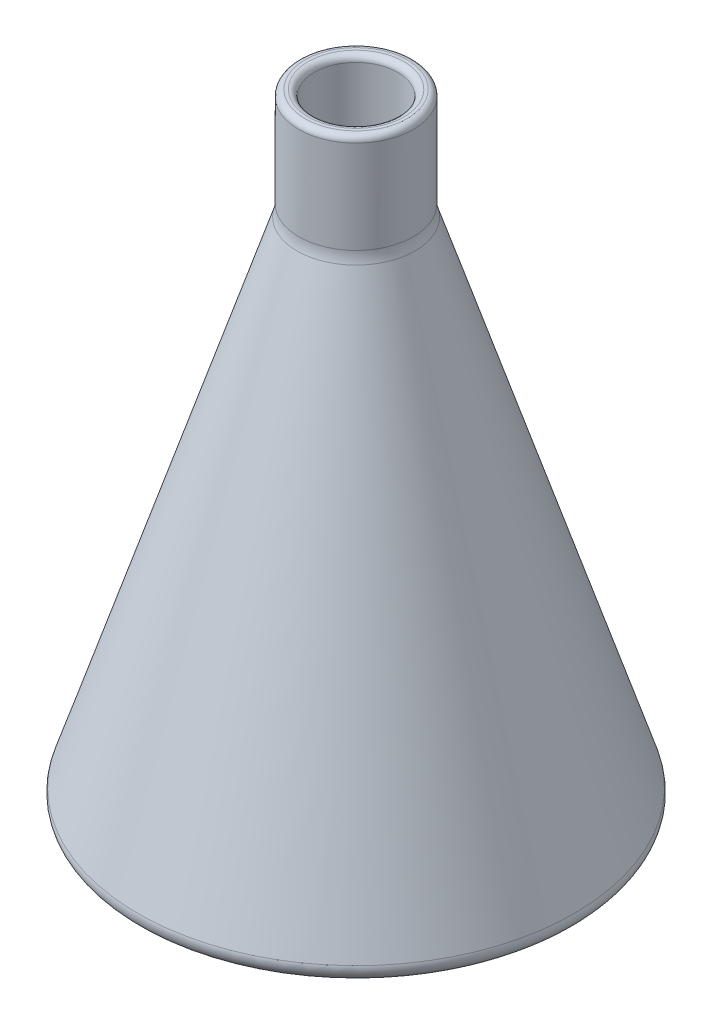
from build123d import *

# Parameters (mm, degrees)
FILLET1_R      = 7.62
FILLET2_R      = 1.27
FILLET3_R      = 2.54
FILLET4_R      = 2.54
REVOLVE2_ANGLE = 20


with BuildPart() as part:
    # Sketch2 → Revolve1 (revolve)
    with BuildSketch(Plane.XY, mode=Mode.PRIVATE) as revolve1_sk:
        Polygon((-11.704475972, 127), (-8.529475972, 127), (-8.529475972, 105.527709861), (-41.475985329, 3.175), (0, 3.175), (0, 0), (-45.672992146, 0), (-11.704475972, 105.527709861), align=None)
    revolve(revolve1_sk.sketch.rotate(Axis((0, 0, 0), (0, 1, 0)), 270), axis=Axis((0, 0, 0), (0, 1, 0)))

    # Fillet1
    fillet1_edges = [part.edges().sort_by_distance(p)[0] for p in [
        (0, 105.527709861, 11.704475972),
    ]]
    fillet(fillet1_edges, radius=FILLET1_R)

    # Fillet2
    fillet2_edges = [part.edges().sort_by_distance(p)[0] for p in [
        (0, 127, 11.704475972),
        (0, 127, 8.529475972),
    ]]
    fillet(fillet2_edges, radius=FILLET2_R)

    # Fillet3
    fillet3_edges = [part.edges().sort_by_distance(p)[0] for p in [
        (0, 0, 45.672992146),
    ]]
    fillet(fillet3_edges, radius=FILLET3_R)

    # Fillet4
    fillet4_edges = [part.edges().sort_by_distance(p)[0] for p in [
        (0, 3.175, 41.475985329),
    ]]
    fillet(fillet4_edges, radius=FILLET4_R)

    # Sketch3 → Revolve2 (revolve)
    with BuildSketch(Plane.XY):
        Polygon((-42.578605395, 9.61312368), (-42.691844754, 9.649574513), (-41.913566134, 12.067400477), (-41.800326776, 12.030949643), align=None)
        Polygon((-38.687212298, 21.702253498), (-38.800451656, 21.738704331), (-38.022173037, 24.156530295), (-37.908933678, 24.120079461), align=None)
        Polygon((-34.7958192, 33.791383316), (-34.909058559, 33.82783415), (-34.130779939, 36.245660113), (-34.017540581, 36.20920928), align=None)
        Polygon((-30.904426103, 45.880513134), (-31.017665461, 45.916963968), (-30.239386842, 48.334789931), (-30.126147483, 48.298339098), align=None)
        Polygon((-27.013033005, 57.969642952), (-27.126272364, 58.006093786), (-26.347993744, 60.42391975), (-26.234754386, 60.387468916), align=None)
        Polygon((-23.121639908, 70.058772771), (-23.234879266, 70.095223604), (-22.456600647, 72.513049568), (-22.343361288, 72.476598734), align=None)
        Polygon((-19.23024681, 82.147902589), (-19.343486169, 82.184353422), (-18.565207549, 84.602179386), (-18.451968191, 84.565728552), align=None)
        Polygon((-15.338853713, 94.237032407), (-15.452093071, 94.27348324), (-14.673814452, 96.691309204), (-14.560575093, 96.654858371), align=None)
    revolve(axis=Axis((0, 0, 0), (0, 1, 0)), revolution_arc=REVOLVE2_ANGLE)


solid = part.part
